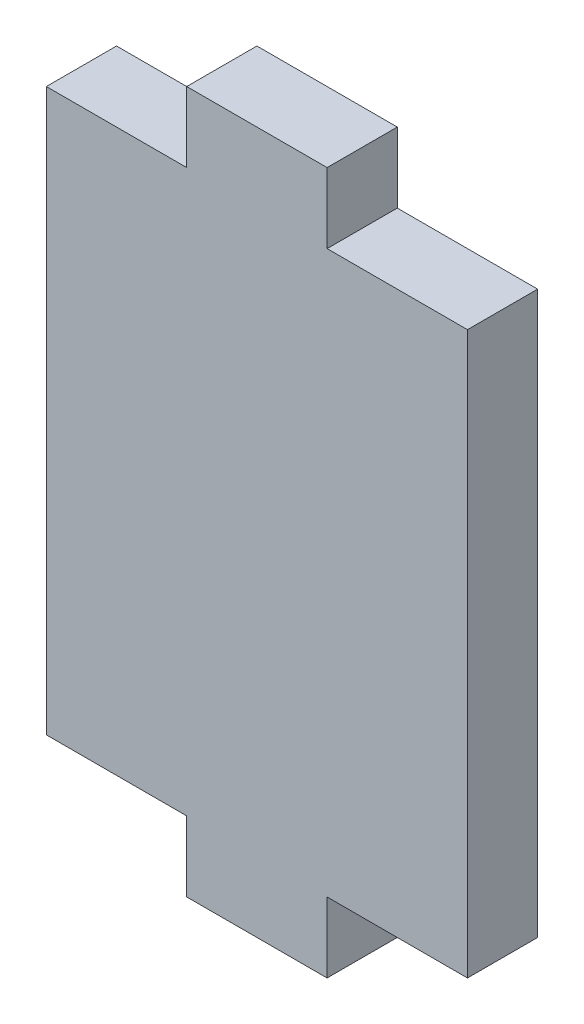
from build123d import *

# Parameters (mm, degrees)
BOSS_EXTRUDE1_DEPTH = 5


with BuildPart() as part:
    # Sketch1 → Boss-Extrude1 (new body)
    with BuildSketch(Plane.XY):
        Polygon((5, 20), (15, 20), (15, -20), (5, -20), (5, -25), (-5, -25), (-5, -20), (-15, -20), (-15, 20), (-5, 20), (-5, 25), (5, 25), align=None)
    extrude(amount=BOSS_EXTRUDE1_DEPTH)


solid = part.part
